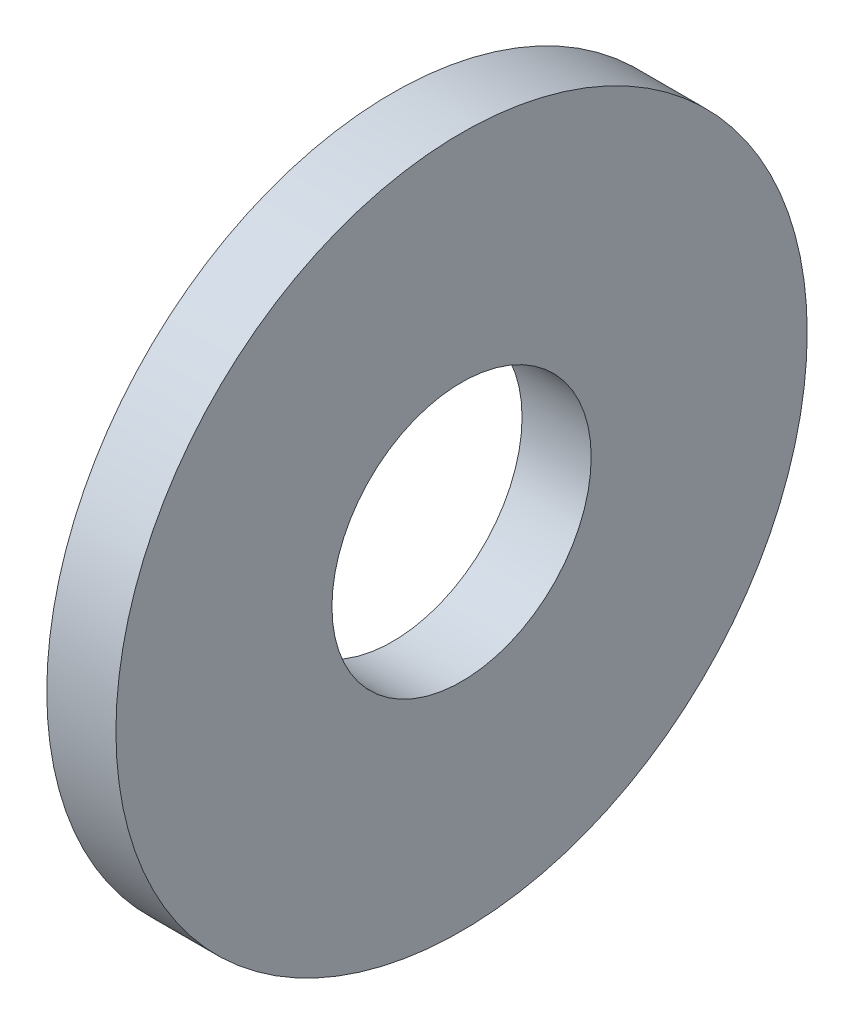
from build123d import *

# Parameters (mm, degrees)
SKETCH1_R           = 12.7
SKETCH1_R_2         = 4.7625
BOSS_EXTRUDE1_DEPTH = 2.54


with BuildPart() as part:
    # Sketch1 → Boss-Extrude1 (new body)
    with BuildSketch(Plane(origin=(0, 0, 0), x_dir=(0, 0, -1), z_dir=(1, 0, 0))):
        Circle(SKETCH1_R)
        Circle(SKETCH1_R_2, mode=Mode.SUBTRACT)
    extrude(amount=BOSS_EXTRUDE1_DEPTH)


solid = part.part
